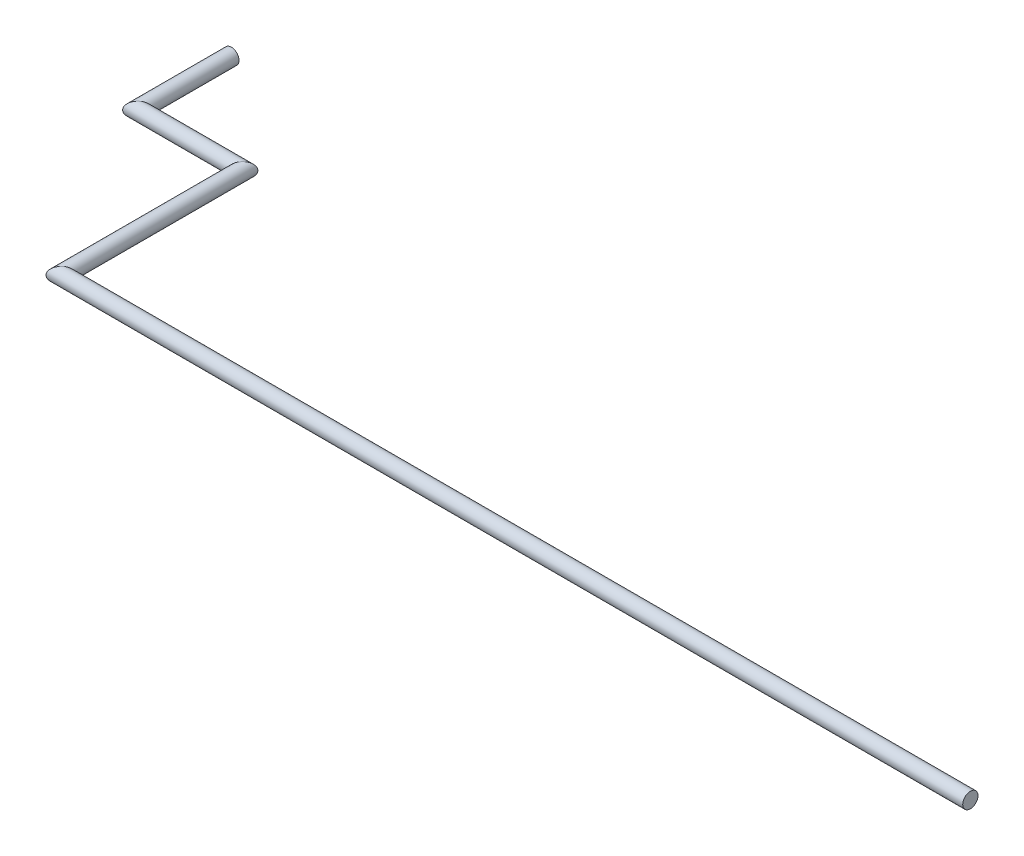
from build123d import *

# Parameters (mm, degrees)
SKETCH2_R = 0.4064


with BuildPart() as part:
    # Sweep1: sweep along a path in Sketch1
    with BuildLine(Plane(origin=(0, 0, 0), x_dir=(1, 0, 0), z_dir=(0, 1, 0))) as sweep1_path:
        Line((0, 0), (-48.387, 0))
        Line((-48.387, 0), (-48.387, 9.652))
        Line((-48.387, 9.652), (-53.9623, 9.652))
        Line((-53.9623, 9.652), (-53.9623, 14.6304))
    # Sketch2 → Sweep1 (sweep)
    with BuildSketch(Plane(origin=(0, 0, 0), x_dir=(0, 0, -1), z_dir=(1, 0, 0))):
        Circle(SKETCH2_R)
    sweep(path=sweep1_path.line, transition=Transition.RIGHT)


solid = part.part
